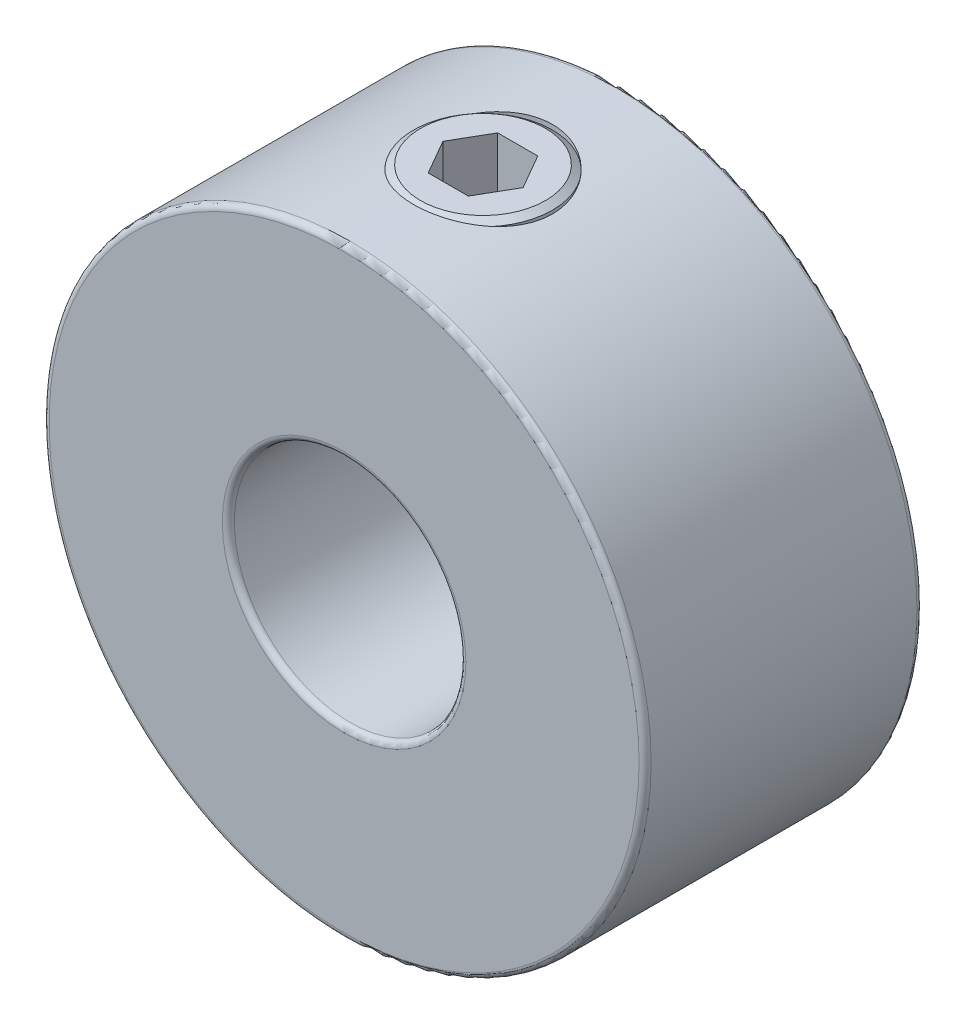
from build123d import *

# Parameters (mm, degrees)
SKETCH1_R          = 6.5
SKETCH1_R_2        = 2.5
EXTRUDE1_DEPTH     = 6
CUT_EXTRUDE1_REACH = 17.724
SKETCH2_R          = 1.5
CUT_EXTRUDE2_DEPTH = 1.2
FILLET1_R          = 0.13


with BuildPart() as part:
    # Sketch1 → Extrude1 (new body)
    with BuildSketch(Plane.XY):
        Circle(SKETCH1_R)
        Circle(SKETCH1_R_2, mode=Mode.SUBTRACT)
    extrude(amount=EXTRUDE1_DEPTH)

    # Sketch2 → Cut-Extrude1 (cut, up to next)
    with BuildSketch(Plane(origin=(0, 6.5, 0), x_dir=(-1, 0, 0), z_dir=(0, 1, 0)), mode=Mode.PRIVATE) as cut_extrude1_sk1:
        with Locations((0, 3)):
            Circle(SKETCH2_R)
    cut_extrude1_tool1 = extrude(cut_extrude1_sk1.sketch, amount=-CUT_EXTRUDE1_REACH, mode=Mode.PRIVATE) & part.part
    add(cut_extrude1_tool1.solids().sort_by_distance((0, 6.5, 3))[0], mode=Mode.SUBTRACT)

    # Fillet1
    fillet1_edges = [part.edges().sort_by_distance(p)[0] for p in [
        (-2.5, 0, 0),
        (-2.5, 0, 6),
        (-6.5, 0, 0),
        (-6.5, 0, 6),
    ]]
    fillet(fillet1_edges, radius=FILLET1_R)


with BuildPart() as body_2:
    # Sketch3 → Revolve1 (revolve)
    with BuildSketch(Plane.XY.offset(3)):
        Polygon((-1.35, 6.5), (-1.5, 6.394968869), (-1.5, 4.178052641), (-0.821947359, 3.5), (0, 3.993875799), (0, 6.5), align=None)
    revolve(axis=Axis((0, 3.993875799, 3), (0, 1, 0)))

    # Sketch4 → Cut-Extrude2 (cut)
    with BuildSketch(Plane(origin=(0, 6.5, 0), x_dir=(0, 0, -1), z_dir=(0, 1, 0))):
        Polygon((-3, 0.866025404), (-3.75, 0.433012702), (-3.75, -0.433012702), (-3, -0.866025404), (-2.25, -0.433012702), (-2.25, 0.433012702), align=None)
    extrude(amount=-CUT_EXTRUDE2_DEPTH, mode=Mode.SUBTRACT)


solid = Compound([part.part, body_2.part])
